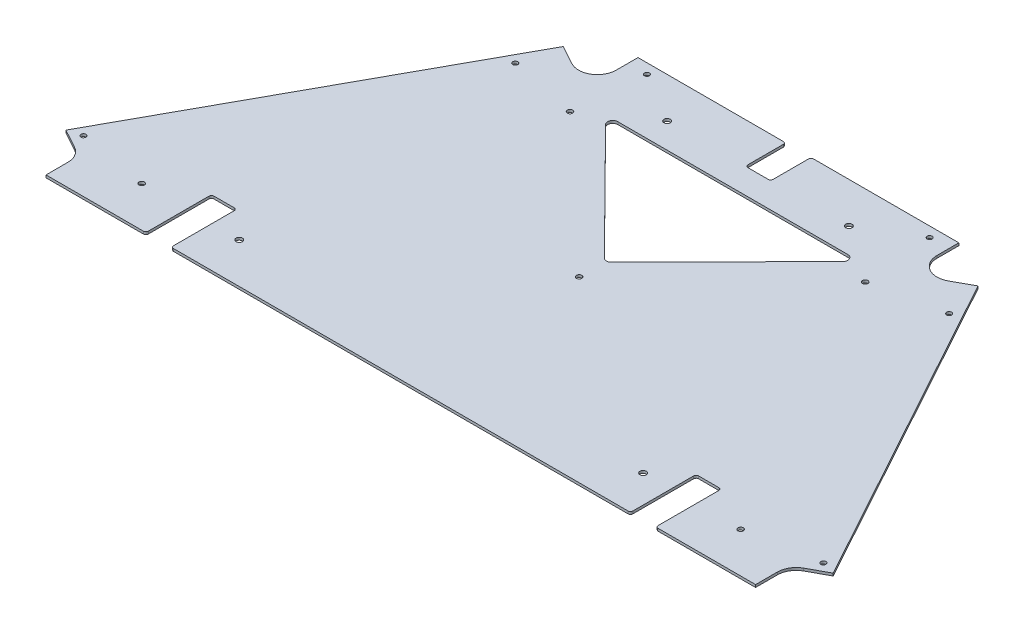
from build123d import *

# Parameters (mm, degrees)
BOSS_EXTRUDE1_DEPTH            = 3.175
SKETCH2_W                      = 31.75
SKETCH2_H                      = 82.55
CUT_EXTRUDE1_DEPTH             = 696.025418567
FILLET1_R                      = 3.175
F_1_4_0_25_DIAMETER_HOLE1_D    = 6.35
F_1_4_CLEARANCE_HOLE1_D        = 6.7564
F_5_16_0_3125_DIAMETER_HOLE1_D = 7.9375
CUT_EXTRUDE2_DEPTH             = 696.025418567
FILLET2_R                      = 6.35
SKETCH12_W                     = 31.75
SKETCH12_H                     = 50.8
CUT_EXTRUDE3_DEPTH             = 696.025418567
FILLET3_R                      = 3.175


with BuildPart() as part:
    # Sketch1 → Boss-Extrude1 (new body)
    with BuildSketch(Plane(origin=(0, 0, 0), x_dir=(1, 0, 0), z_dir=(0, 1, 0))):
        with BuildLine():
            Line((-260.839523021, 465.231358695), (-482.578348021, 61.34030281))
            Line((-482.578348021, 61.34030281), (-458.5319125, 48.13865281))
            ThreePointArc((-458.5319125, 48.13865281), (-449.57100781, 39.462418136), (-446.278, 27.432))
            Line((-446.278, 27.432), (-446.278, 0))
            Line((-446.278, 0), (446.278, 0))
            Line((446.278, 0), (446.278, 27.432))
            ThreePointArc((446.278, 27.432), (449.57100781, 39.462418136), (458.5319125, 48.13865281))
            Line((458.5319125, 48.13865281), (482.578348021, 61.34030281))
            Line((482.578348021, 61.34030281), (260.839523021, 465.231358695))
            Line((260.839523021, 465.231358695), (236.7930875, 452.029708695))
            ThreePointArc((236.7930875, 452.029708695), (213.394581864, 452.407369315), (201.803, 472.736361505))
            Line((201.803, 472.736361505), (201.803, 500.168361505))
            Line((201.803, 500.168361505), (-201.803, 500.168361505))
            Line((-201.803, 500.168361505), (-201.803, 472.736361505))
            ThreePointArc((-201.803, 472.736361505), (-213.394581864, 452.407369315), (-236.7930875, 452.029708695))
            Line((-236.7930875, 452.029708695), (-260.839523021, 465.231358695))
        make_face()
    extrude(amount=BOSS_EXTRUDE1_DEPTH)

    # Sketch2 → Cut-Extrude1 (cut, through all)
    with BuildSketch(Plane(origin=(0, 3.175, 0), x_dir=(1, 0, 0), z_dir=(0, 1, 0))):
        with Locations((-304.8, 41.275)):
            Rectangle(SKETCH2_W, SKETCH2_H)
        with Locations((304.8, 41.275)):
            Rectangle(SKETCH2_W, SKETCH2_H)
    extrude(amount=-CUT_EXTRUDE1_DEPTH, mode=Mode.SUBTRACT)

    # Fillet1
    fillet1_edges = [part.edges().sort_by_distance(p)[0] for p in [
        (-288.925, 1.5875, -82.55),
        (-288.925, 1.5875, 0),
        (-320.675, 1.5875, 0),
        (-320.675, 1.5875, -82.55),
        (288.925, 1.5875, 0),
        (288.925, 1.5875, -82.55),
        (320.675, 1.5875, -82.55),
        (320.675, 1.5875, 0),
    ]]
    fillet(fillet1_edges, radius=FILLET1_R)

    # 1/4 (0.25) Diameter Hole1 (through all)
    with Locations(Plane(origin=(0, 3.175, 0), x_dir=(1, 0, 0), z_dir=(0, 1, 0))):
        with Locations((-465.394777961, 66.250083744), (-272.870715461, 416.927268429), (-177.8, 487.468361505), (465.394777961, 66.250083744), (272.870715461, 416.927268429), (177.8, 487.468361505)):
            Hole(F_1_4_0_25_DIAMETER_HOLE1_D / 2)

    # 1/4 Clearance Hole1 (through all)
    with Locations(Plane(origin=(0, 3.175, 0), x_dir=(1, 0, 0), z_dir=(0, 1, 0))):
        with Locations((0, 224.282), (-376.682, 50.8), (-185.674, 398.526), (376.682, 50.8), (185.674, 398.526)):
            Hole(F_1_4_CLEARANCE_HOLE1_D / 2)

    # 5/16 (0.3125) Diameter Hole1 (through all)
    with Locations(Plane(origin=(0, 3.175, 0), x_dir=(1, 0, 0), z_dir=(0, 1, 0))):
        with Locations((-254, 50.8), (-114.3, 449.368361505), (254, 50.8), (114.3, 449.368361505)):
            Hole(F_5_16_0_3125_DIAMETER_HOLE1_D / 2)

    # Sketch11 → Cut-Extrude2 (cut, through all)
    with BuildSketch(Plane(origin=(0, 3.175, 0), x_dir=(1, 0, 0), z_dir=(0, 1, 0))):
        Polygon((0, 256.032), (159.899523893, 417.618361505), (-159.899523893, 417.618361505), align=None)
    extrude(amount=-CUT_EXTRUDE2_DEPTH, mode=Mode.SUBTRACT)

    # Fillet2
    fillet2_edges = [part.edges().sort_by_distance(p)[0] for p in [
        (0, 1.5875, -256.032),
        (-159.899523893, 1.5875, -417.618361505),
        (159.899523893, 1.5875, -417.618361505),
    ]]
    fillet(fillet2_edges, radius=FILLET2_R)

    # Sketch12 → Cut-Extrude3 (cut, through all)
    with BuildSketch(Plane(origin=(0, 3.175, 0), x_dir=(1, 0, 0), z_dir=(0, 1, 0))):
        with Locations((0, 474.768361505)):
            Rectangle(SKETCH12_W, SKETCH12_H)
    extrude(amount=-CUT_EXTRUDE3_DEPTH, mode=Mode.SUBTRACT)

    # Fillet3
    fillet3_edges = [part.edges().sort_by_distance(p)[0] for p in [
        (-15.875, 1.5875, -449.368361505),
        (-15.875, 1.5875, -500.168361505),
        (15.875, 1.5875, -500.168361505),
        (15.875, 1.5875, -449.368361505),
    ]]
    fillet(fillet3_edges, radius=FILLET3_R)


solid = part.part
